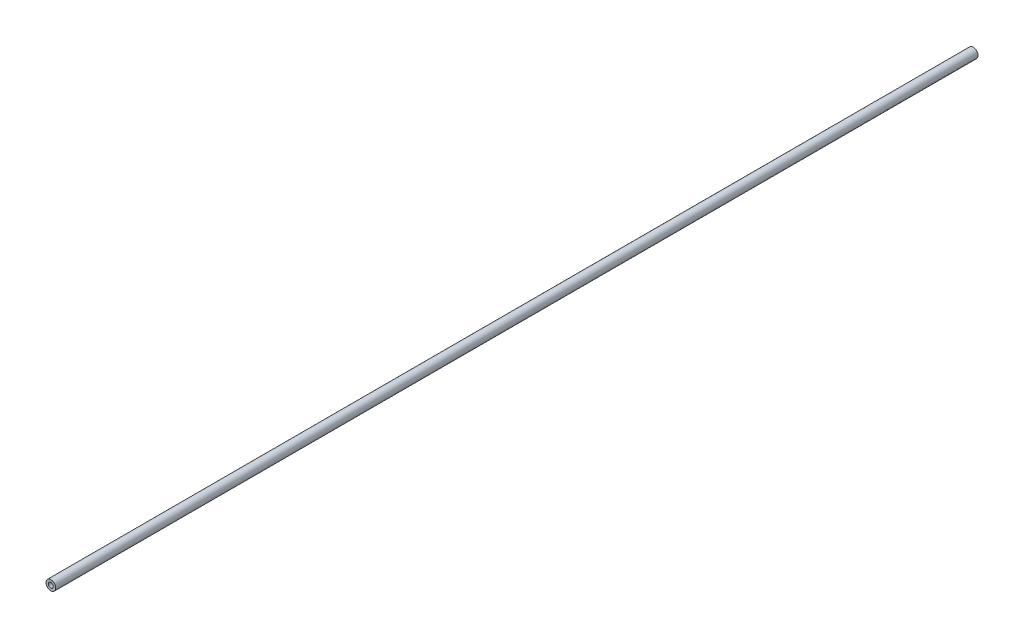
from build123d import *

# Parameters (mm, degrees)
SKETCH1_R           = 2
SKETCH1_R_2         = 1
BOSS_EXTRUDE1_DEPTH = 380


with BuildPart() as part:
    # Sketch1 → Boss-Extrude1 (new body)
    with BuildSketch(Plane.XY):
        Circle(SKETCH1_R)
        Circle(SKETCH1_R_2, mode=Mode.SUBTRACT)
    extrude(amount=BOSS_EXTRUDE1_DEPTH)


solid = part.part
